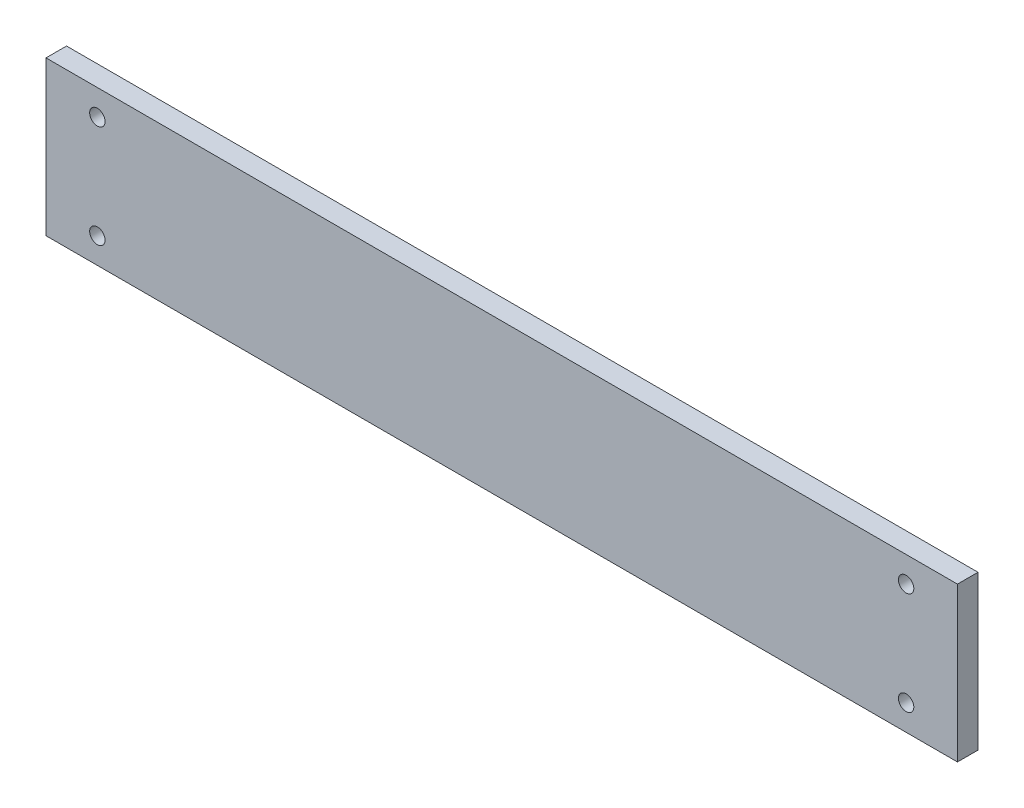
from build123d import *

# Parameters (mm, degrees)
SKETCH_1_W      = 177.5
SKETCH_1_H      = 30
SKETCH_1_R      = 1.5
EXTRUDE_1_DEPTH = 4


with BuildPart() as part:
    # 草图1 → 凸台-拉伸1 (new body)
    with BuildSketch(Plane.XY):
        with Locations((-17.573961564, 27.197653301)):
            Rectangle(SKETCH_1_W, SKETCH_1_H)
        with Locations((-96.323961564, 37.197653301)):
            Circle(SKETCH_1_R, mode=Mode.SUBTRACT)
        with Locations((-96.323961564, 17.197653301)):
            Circle(SKETCH_1_R, mode=Mode.SUBTRACT)
        with Locations((61.176038436, 37.197653301)):
            Circle(SKETCH_1_R, mode=Mode.SUBTRACT)
        with Locations((61.176038436, 17.197653301)):
            Circle(SKETCH_1_R, mode=Mode.SUBTRACT)
    extrude(amount=EXTRUDE_1_DEPTH)


solid = part.part
